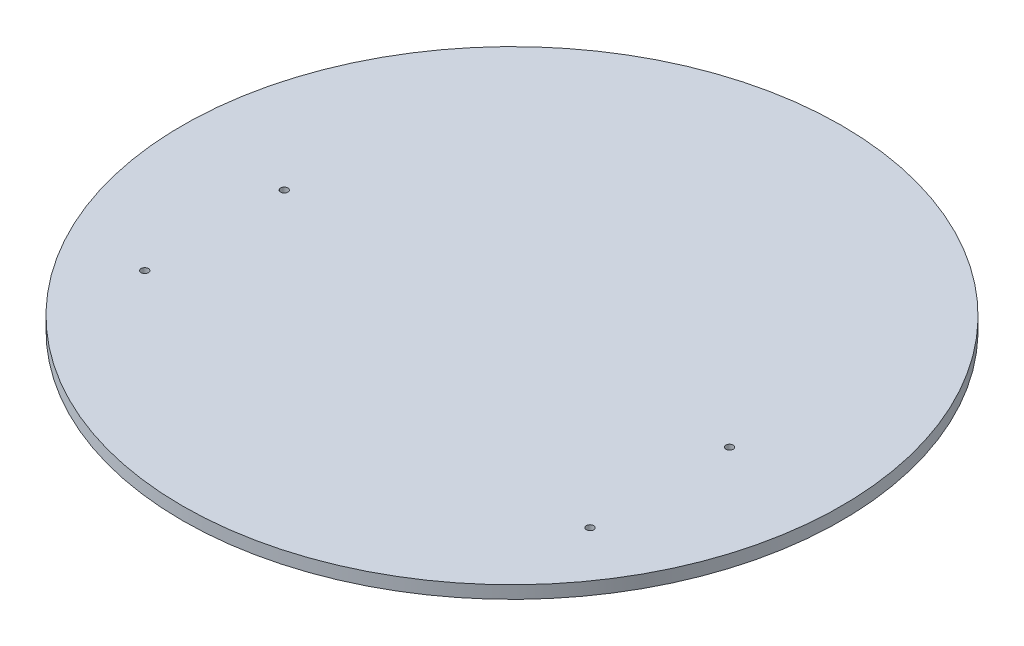
from build123d import *

# Parameters (mm, degrees)
SKETCH1_R             = 164.975
BOSS_EXTRUDE1_DEPTH   = 6.35
F_6_CLEARANCE_HOLE1_D = 3.6576


with BuildPart() as part:
    # Sketch1 → Boss-Extrude1 (new body)
    with BuildSketch(Plane(origin=(0, 0, 0), x_dir=(1, 0, 0), z_dir=(0, 1, 0))):
        with Locations(Location((0, 0, 0), (0, 0, 270))):
            Circle(SKETCH1_R)
    extrude(amount=BOSS_EXTRUDE1_DEPTH)

    # #6 Clearance Hole1 (through all)
    with Locations(Plane(origin=(111.465, 0, 2.54), x_dir=(0, 0, -1), z_dir=(0, -1, 0))):
        with Locations((0, 0), (-69.85, 0), (-69.85, -222.93), (0, -222.93)):
            Hole(F_6_CLEARANCE_HOLE1_D / 2)


solid = part.part
